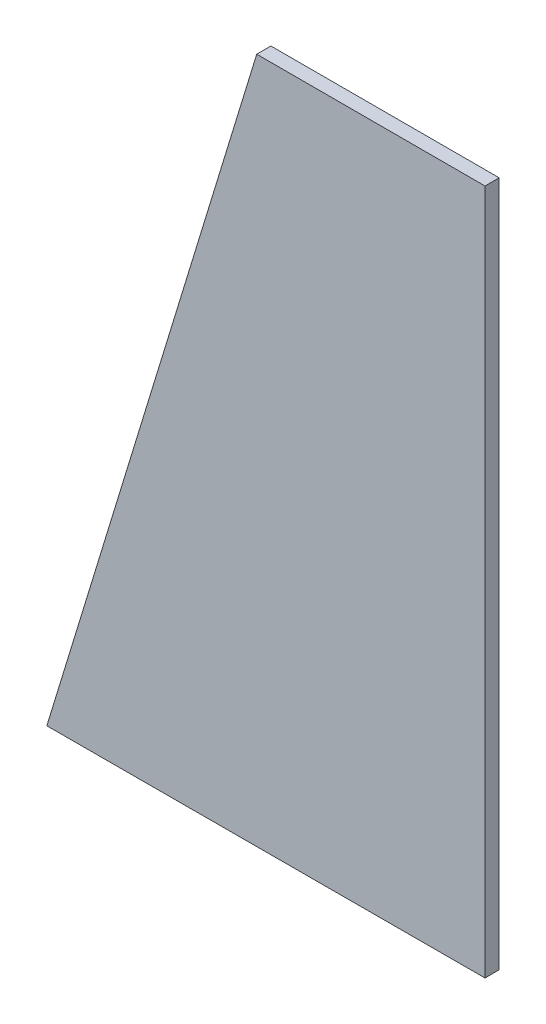
from build123d import *

# Parameters (mm, degrees)
BOSS_EXTRUDE1_DEPTH = 10.16


with BuildPart() as part:
    # Sketch1 → Boss-Extrude1 (new body)
    with BuildSketch(Plane.XY):
        Polygon((334.335599293, 2062.48), (20.308640402, 2061.999689691), (170.73738127, 2554.029930653), (334.335599293, 2554.029930653), align=None)
    extrude(amount=BOSS_EXTRUDE1_DEPTH)


solid = part.part
